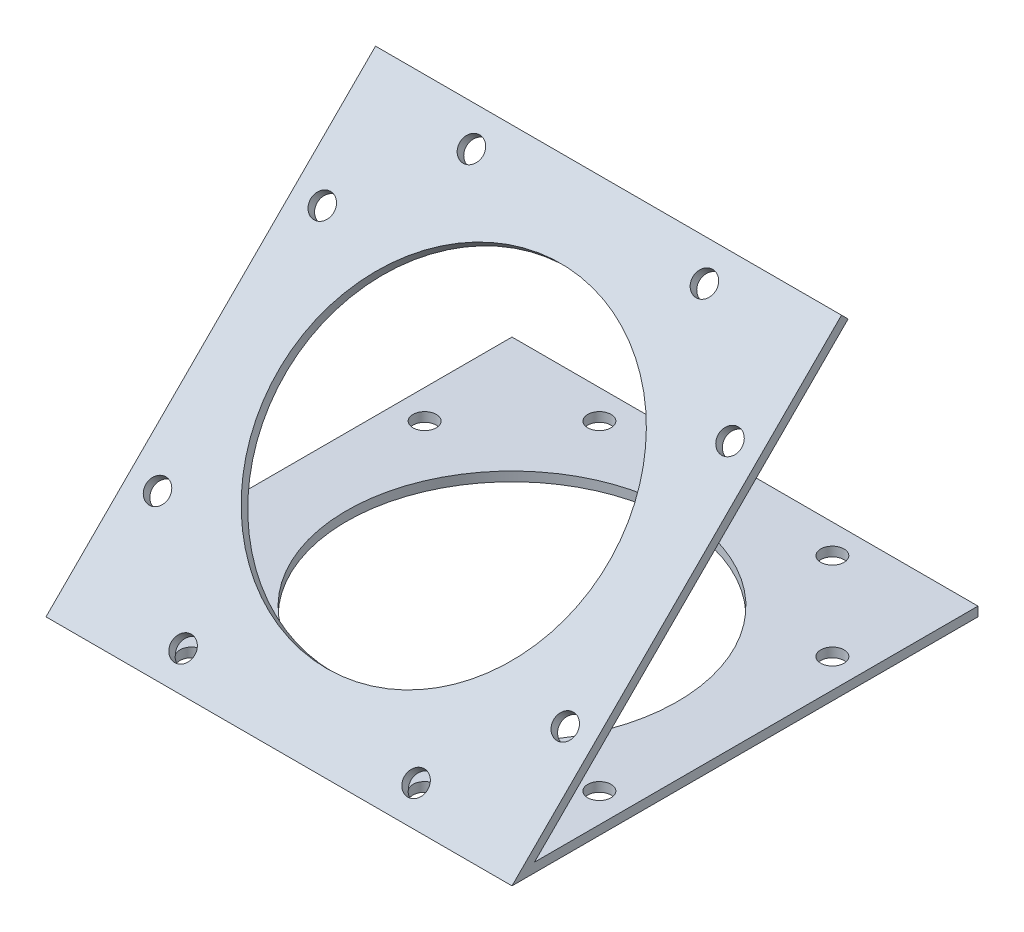
from build123d import *
from build123d.topology import SkipClean

# Parameters (mm, degrees)
EXTRUDE_1_DEPTH     = 200
SKETCH_4_R          = 5
CUT_EXTRUDE_3_DEPTH = 5
SKETCH_5_R          = 5
CUT_EXTRUDE_4_DEPTH = 5
SKETCH_6_R          = 71
CUT_EXTRUDE_5_DEPTH = 10
SKETCH_7_R          = 71
CUT_EXTRUDE_6_DEPTH = 10


with BuildPart() as part:
    # 草图1 → 凸台-拉伸1 (new body)
    with BuildSketch(Plane(origin=(0, 0, 0), x_dir=(0, 0, -1), z_dir=(1, 0, 0))):
        Polygon((141.421356237, 141.421356237), (0, 0), (200, 0), (200, 4), (9.656854249, 4), (144.249783362, 138.592929113), align=None)
    extrude(amount=EXTRUDE_1_DEPTH)

    # 草图4 → 切除-拉伸3 (cut)
    with SkipClean():  # the faces are left unmerged after this step: merging them gives an invalid solid
        with BuildSketch(Plane(origin=(0, 0, 0), x_dir=(1, 0, 0), z_dir=(0, 0.7071067811865512, 0.7071067811865438))):
            with Locations(Location((12.5, 150, 0), (0, 0, 270))):
                Circle(SKETCH_4_R)
            with Locations(Location((12.5, 50, 0), (0, 0, 270))):
                Circle(SKETCH_4_R)
            with Locations(Location((50, 187.5, 0), (0, 0, 270))):
                Circle(SKETCH_4_R)
            with Locations(Location((150, 187.5, 0), (0, 0, 270))):
                Circle(SKETCH_4_R)
            with Locations(Location((187.5, 50, 0), (0, 0, 270))):
                Circle(SKETCH_4_R)
            with Locations(Location((187.5, 150, 0), (0, 0, 270))):
                Circle(SKETCH_4_R)
            with Locations(Location((150, 12.5, 0), (0, 0, 325.345312559))):
                Circle(SKETCH_4_R)
            with Locations(Location((50, 12.5, 0), (0, 0, 325.345312559))):
                Circle(SKETCH_4_R)
        extrude(amount=-CUT_EXTRUDE_3_DEPTH, mode=Mode.SUBTRACT)

    # 草图5 → 切除-拉伸4 (cut)
    with BuildSketch(Plane.XZ):
        with Locations(Location((12.5, -50, 0), (0, 0, 270))):
            Circle(SKETCH_5_R)
        with Locations(Location((12.5, -150, 0), (0, 0, 270))):
            Circle(SKETCH_5_R)
        with Locations(Location((50, -187.5, 0), (0, 0, 270))):
            Circle(SKETCH_5_R)
        with Locations(Location((150, -187.5, 0), (0, 0, 270))):
            Circle(SKETCH_5_R)
        with Locations(Location((150, -12.5, 0), (0, 0, 34.654687441))):
            Circle(SKETCH_5_R)
        with Locations(Location((50, -12.5, 0), (0, 0, 34.654687441))):
            Circle(SKETCH_5_R)
        with Locations(Location((187.5, -150, 0), (0, 0, 270))):
            Circle(SKETCH_5_R)
        with Locations(Location((187.5, -50, 0), (0, 0, 270))):
            Circle(SKETCH_5_R)
    extrude(amount=-CUT_EXTRUDE_4_DEPTH, mode=Mode.SUBTRACT)

    # 草图6 → 切除-拉伸5 (cut)
    with BuildSketch(Plane(origin=(0, 0, 0), x_dir=(1, 0, 0), z_dir=(0, 0.7071067811865512, 0.7071067811865439))):
        with Locations(Location((100, 100, 0), (0, 0, 270))):
            Circle(SKETCH_6_R)
    extrude(amount=-CUT_EXTRUDE_5_DEPTH, mode=Mode.SUBTRACT)

    # 草图7 → 切除-拉伸6 (cut)
    with BuildSketch(Plane.XZ):
        with Locations(Location((100, -100, 0), (0, 0, 270))):
            Circle(SKETCH_7_R)
    extrude(amount=-CUT_EXTRUDE_6_DEPTH, mode=Mode.SUBTRACT)


solid = part.part
